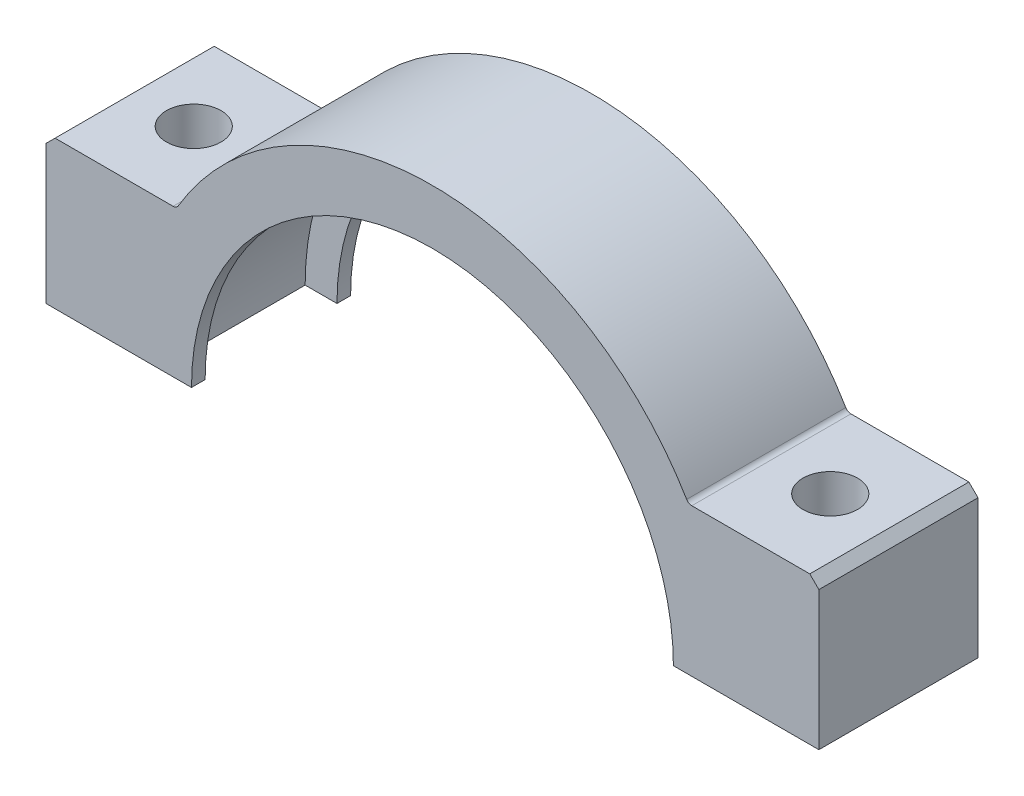
from build123d import *

# Parameters (mm, degrees)
DODANIE_WYCI_GNI_CIE1_DEPTH = 14.5
OTW_R_12_0_12_1_D           = 12
DODANIE_WYCI_GNI_CIE2_DEPTH = 3
DODANIE_WYCI_GNI_CIE3_START = 3
DODANIE_WYCI_GNI_CIE3_DEPTH = 3


with BuildPart() as part:
    # Szkic1 → Dodanie-wyciągnięcie1 (new, symmetric)
    with BuildSketch(Plane.XY):
        with BuildLine():
            Line((-85, 30.5), (-83, 32.5))
            Line((-83, 32.5), (-57.046389972, 32.5))
            ThreePointArc((-57.046389972, 32.5), (-56.394946898, 32.672548578), (-55.914331752, 33.144946896))
            ThreePointArc((-55.914331752, 33.144946896), (0, 65), (55.914331752, 33.144946896))
            ThreePointArc((55.914331752, 33.144946896), (56.394946898, 32.672548578), (57.046389972, 32.5))
            Line((57.046389972, 32.5), (83, 32.5))
            Line((83, 32.5), (85, 30.5))
            Line((85, 30.5), (85, 0))
            Line((85, 0), (60, 0))
            ThreePointArc((60, 0), (0, 60), (-60, 0))
            Line((-60, 0), (-85, 0))
            Line((-85, 0), (-85, 30.5))
        make_face()
    extrude(amount=DODANIE_WYCI_GNI_CIE1_DEPTH, both=True)

    # Otwór Ø12.0 (12)1 (through all)
    with Locations(Plane(origin=(0, 0, 0), x_dir=(-1, 0, 0), z_dir=(0, -1, 0))):
        with Locations((70, 0), (-70, 0)):
            Hole(OTW_R_12_0_12_1_D / 2)

    # Szkic4 → Dodanie-wyciągnięcie2 (add)
    with BuildSketch(Plane(origin=(0, 0, -14.5), x_dir=(-1, 0, 0), z_dir=(0, 0, -1))):
        with BuildLine():
            Line((-53, 0), (-85, 0))
            Line((-85, 0), (-85, 30.5))
            Line((-85, 30.5), (-83, 32.5))
            Line((-83, 32.5), (-57.046389972, 32.5))
            ThreePointArc((-57.046389972, 32.5), (-56.394946898, 32.672548578), (-55.914331752, 33.144946896))
            ThreePointArc((-55.914331752, 33.144946896), (0, 65), (55.914331752, 33.144946896))
            ThreePointArc((55.914331752, 33.144946896), (56.394946898, 32.672548578), (57.046389972, 32.5))
            Line((57.046389972, 32.5), (83, 32.5))
            Line((83, 32.5), (85, 30.5))
            Line((85, 30.5), (85, 0))
            Line((85, 0), (53, 0))
            ThreePointArc((53, 0), (0, 53), (-53, 0))
        make_face()
    extrude(amount=DODANIE_WYCI_GNI_CIE2_DEPTH)

    # Szkic5 → Dodanie-wyciągnięcie3 (add)
    with BuildSketch(Plane.XY.offset(14.5).offset(DODANIE_WYCI_GNI_CIE3_START)):
        with BuildLine():
            Line((-53, 0), (-85, 0))
            Line((-85, 0), (-85, 30.5))
            Line((-85, 30.5), (-83, 32.5))
            Line((-83, 32.5), (-57.046389972, 32.5))
            ThreePointArc((-57.046389972, 32.5), (-56.394946898, 32.672548578), (-55.914331752, 33.144946896))
            ThreePointArc((-55.914331752, 33.144946896), (0, 65), (55.914331752, 33.144946896))
            ThreePointArc((55.914331752, 33.144946896), (56.394946898, 32.672548578), (57.046389972, 32.5))
            Line((57.046389972, 32.5), (83, 32.5))
            Line((83, 32.5), (85, 30.5))
            Line((85, 30.5), (85, 0))
            Line((85, 0), (53, 0))
            ThreePointArc((53, 0), (0, 53), (-53, 0))
        make_face()
    extrude(amount=-DODANIE_WYCI_GNI_CIE3_DEPTH)


solid = part.part
